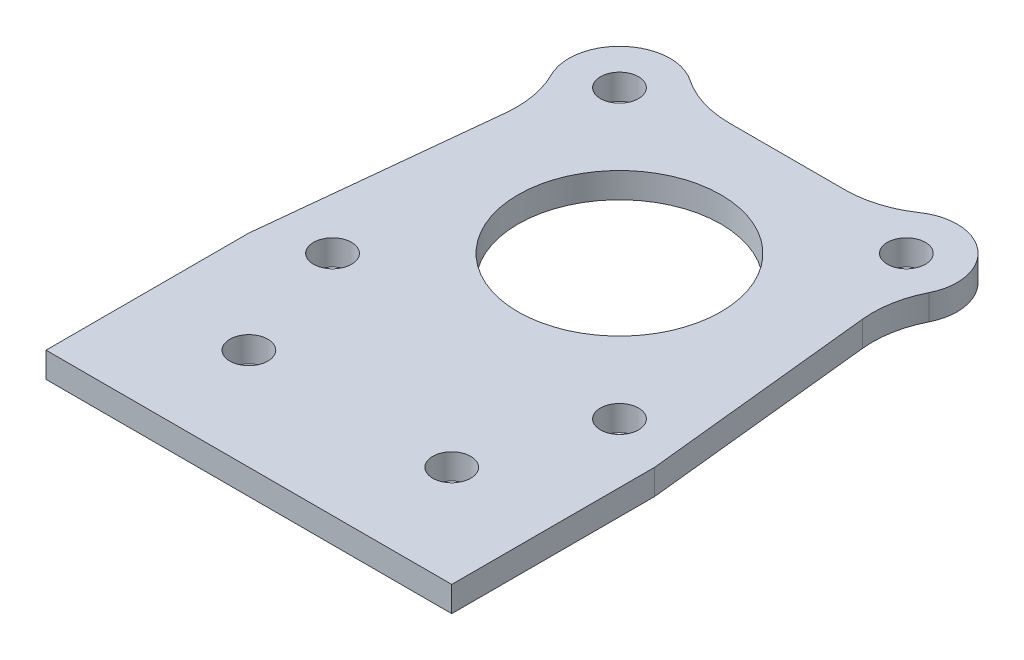
from build123d import *

# Parameters (mm, degrees)
BOSS_EXTRUDE1_DEPTH            = 3.175
F_1_1_DIAMETER_HOLE1_D         = 25.4
SKETCH6_R                      = 2.38125
CUT_EXTRUDE1_DEPTH             = 63.666104275
SKETCH7_R                      = 6.35
SKETCH7_R_2                    = 2.38125
BOSS_EXTRUDE2_DEPTH            = 3.175
F_3_16_0_1875_DIAMETER_HOLE1_D = 4.7625
FILLET1_R                      = 12.7


with BuildPart() as part:
    # Sketch1 → Boss-Extrude1 (new body)
    with BuildSketch(Plane(origin=(0, 0, 0), x_dir=(1, 0, 0), z_dir=(0, 1, 0))):
        Polygon((0, 42), (-42, 42), (-46.4, 0), (-46.4, -25.4), (4.4, -25.4), (4.4, 0), align=None)
    extrude(amount=BOSS_EXTRUDE1_DEPTH)

    # 1 (1) Diameter Hole1 (through all)
    with Locations(Plane(origin=(0, 3.175, 0), x_dir=(1, 0, 0), z_dir=(0, 1, 0))):
        with Locations((-21, 21)):
            Hole(F_1_1_DIAMETER_HOLE1_D / 2)

    # Sketch6 → Cut-Extrude1 (cut, through all)
    with BuildSketch(Plane(origin=(0, 3.175, 0), x_dir=(1, 0, 0), z_dir=(0, 1, 0))):
        with Locations(Location((-38.960512242, 38.960512242, 0), (0, 0, 270))):
            Circle(SKETCH6_R)
        with Locations(Location((-38.960512242, 3.039487758, 0), (0, 0, 270))):
            Circle(SKETCH6_R)
        with Locations(Location((-3.039487758, 3.039487758, 0), (0, 0, 270))):
            Circle(SKETCH6_R)
        with Locations(Location((-3.039487758, 38.960512242, 0), (0, 0, 270))):
            Circle(SKETCH6_R)
    extrude(amount=-CUT_EXTRUDE1_DEPTH, mode=Mode.SUBTRACT)

    # Sketch7 → Boss-Extrude2 (add)
    # profile 1 of 2: a face of its own
    with BuildSketch(Plane(origin=(0, 3.175, 0), x_dir=(1, 0, 0), z_dir=(0, 1, 0))):
        with Locations((-38.960512242, 38.960512242)):
            Circle(SKETCH7_R)
        with Locations(Location((-38.960512242, 38.960512242, 0), (0, 0, 270))):
            Circle(SKETCH7_R_2, mode=Mode.SUBTRACT)
    # profile 2 of 2: a face of its own
    with BuildSketch(Plane(origin=(0, 3.175, 0), x_dir=(1, 0, 0), z_dir=(0, 1, 0))):
        with Locations((-3.039487758, 38.960512242)):
            Circle(SKETCH7_R)
        with Locations(Location((-3.039487758, 38.960512242, 0), (0, 0, 270))):
            Circle(SKETCH7_R_2, mode=Mode.SUBTRACT)
    extrude(amount=-BOSS_EXTRUDE2_DEPTH)

    # 3/16 (0.1875) Diameter Hole1 (through all)
    with Locations(Plane(origin=(0, 3.175, 0), x_dir=(1, 0, 0), z_dir=(0, 1, 0))):
        with Locations((-33.7, -12.7), (-8.3, -12.7)):
            Hole(F_3_16_0_1875_DIAMETER_HOLE1_D / 2)

    # Fillet1
    fillet1_edges = [part.edges().sort_by_distance(p)[0] for p in [
        (-42.844694729, 1.5875, -33.937004861),
        (-33.385208289, 1.5875, -42),
        (0.844694729, 1.5875, -33.937004861),
        (-8.614791711, 1.5875, -42),
    ]]
    fillet(fillet1_edges, radius=FILLET1_R)


solid = part.part
